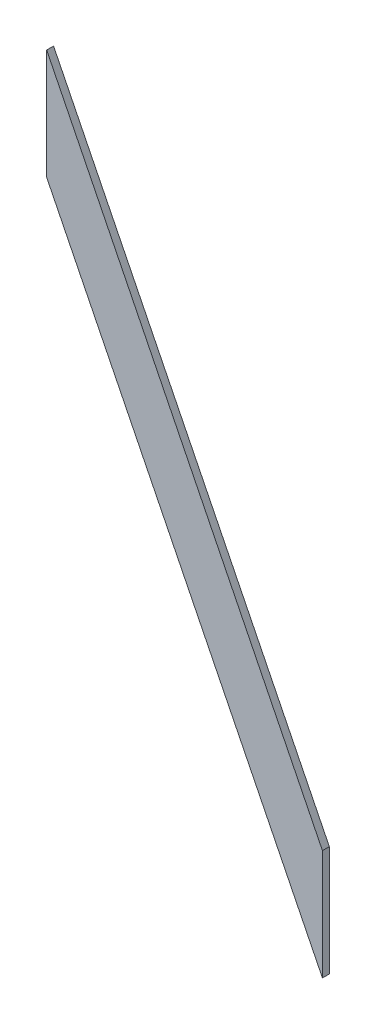
from build123d import *

# Parameters (mm, degrees)
BOSS_EXTRUDE1_DEPTH = 3.175


with BuildPart() as part:
    # Sketch1 → Boss-Extrude1 (new body)
    with BuildSketch(Plane.XY):
        Polygon((0, -25.4), (0, 25.4), (127, -230.415350808), (127, -281.215350808), align=None)
    extrude(amount=BOSS_EXTRUDE1_DEPTH)


solid = part.part
